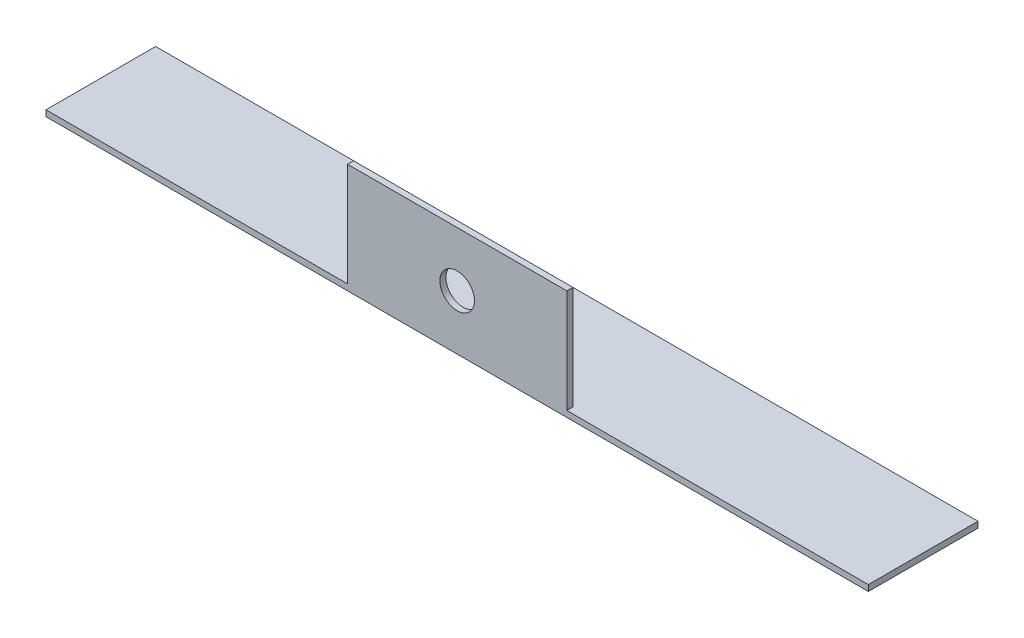
from build123d import *

# Parameters (mm, degrees)
SKETCH1_W           = 381
SKETCH1_H           = 50.8
BOSS_EXTRUDE1_DEPTH = 2.794
SKETCH2_W           = 381
SKETCH2_H           = 2.794
BOSS_EXTRUDE2_DEPTH = 48.006
SKETCH3_R           = 8
CUT_EXTRUDE1_DEPTH  = 2.794
SKETCH4_W           = 139.7
SKETCH4_H           = 48.006
CUT_EXTRUDE2_DEPTH  = 2.794


with BuildPart() as part:
    # Sketch1 → Boss-Extrude1 (new body)
    with BuildSketch(Plane(origin=(0, 0, 0), x_dir=(1, 0, 0), z_dir=(0, 1, 0))):
        Rectangle(SKETCH1_W, SKETCH1_H)
    extrude(amount=BOSS_EXTRUDE1_DEPTH)

    # Sketch2 → Boss-Extrude2 (add)
    with BuildSketch(Plane(origin=(0, 2.794, 0), x_dir=(1, 0, 0), z_dir=(0, 1, 0))):
        with Locations((0, -24.003)):
            Rectangle(SKETCH2_W, SKETCH2_H)
    extrude(amount=BOSS_EXTRUDE2_DEPTH)

    # Sketch3 → Cut-Extrude1 (cut)
    with BuildSketch(Plane.XY.offset(25.4)):
        with Locations((0, 25.4)):
            Circle(SKETCH3_R)
    extrude(amount=-CUT_EXTRUDE1_DEPTH, mode=Mode.SUBTRACT)

    # Sketch4 → Cut-Extrude2 (cut)
    with BuildSketch(Plane.XY.offset(25.4)):
        with Locations((-120.65, 26.797)):
            Rectangle(SKETCH4_W, SKETCH4_H)
        with Locations((120.65, 26.797)):
            Rectangle(SKETCH4_W, SKETCH4_H)
    extrude(amount=-CUT_EXTRUDE2_DEPTH, mode=Mode.SUBTRACT)


solid = part.part
